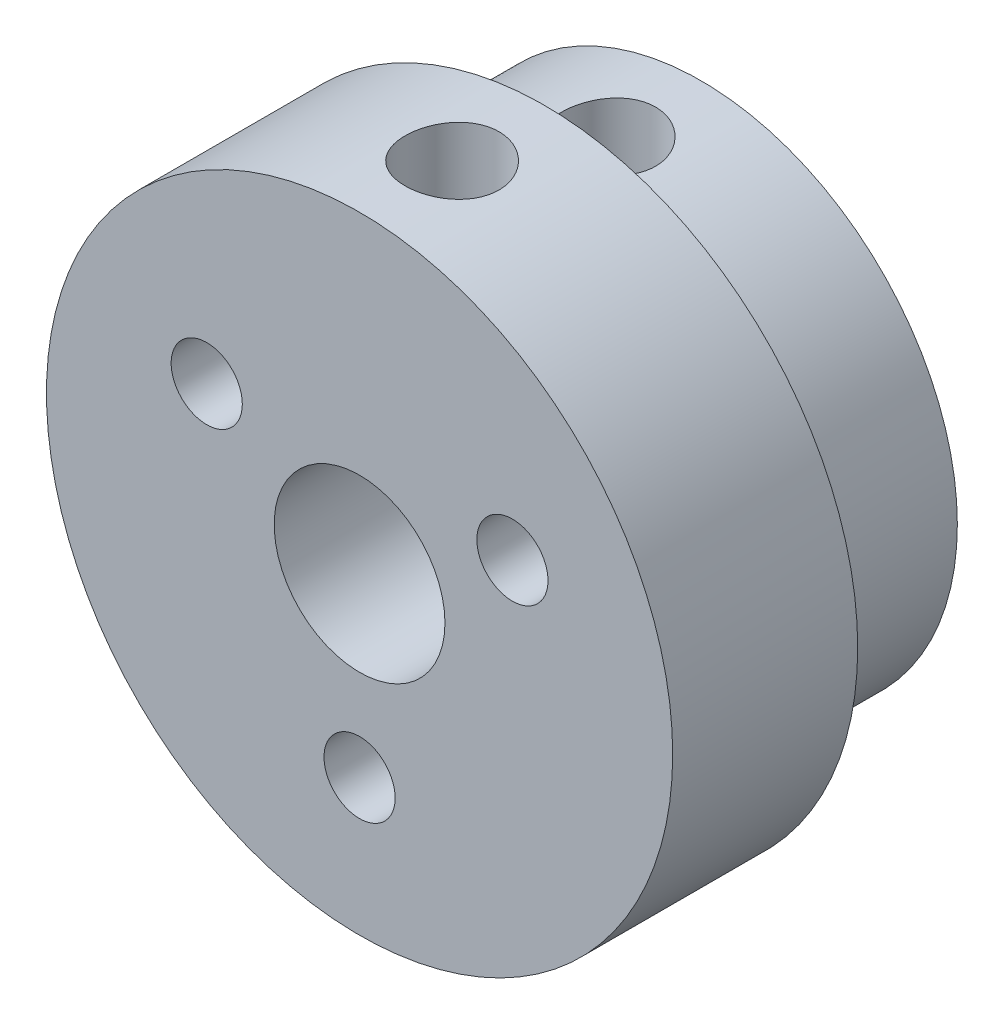
from build123d import *

# Parameters (mm, degrees)
M3X0_5_TAPPED_HOLE1_D               = 2.5
M4X0_7_TAPPED_HOLE1_D               = 3.3
M4X0_7_TAPPED_HOLE1_DEPTH           = 10.999
M4X0_7_TAPPED_HOLE1_TIP             = 0.991420021
M4X0_7_TAPPED_HOLE1_ON_FACE_2_D     = 3.3
M4X0_7_TAPPED_HOLE1_ON_FACE_2_DEPTH = 10.999
M4X0_7_TAPPED_HOLE1_ON_FACE_2_TIP   = 0.991420021


with BuildPart() as part:
    # Sketch2 → Revolve1 (revolve)
    with BuildSketch(Plane(origin=(0, 0, 0), x_dir=(0, 0, -1), z_dir=(1, 0, 0)), mode=Mode.PRIVATE) as revolve1_sk:
        Polygon((0, 3), (0, 11), (6.5, 11), (6.5, 9), (12, 9), (12, 3), align=None)
    revolve(revolve1_sk.sketch.rotate(Axis((0, 0, 0), (0, 0, -1)), 90), axis=Axis((0, 0, 0), (0, 0, -1)))

    # M3x0.5 Tapped Hole1 (through all)
    with Locations(Plane.XY):
        with Locations((35.910466859, 13.470944302), (5.369357503, 3.1), (-5.369357503, 3.1), (0, -6.2)):
            Hole(M3X0_5_TAPPED_HOLE1_D / 2)

    # M4x0.7 Tapped Hole1
    with Locations(Plane(origin=(0, 9, -8.75), x_dir=(1, 0, 0), z_dir=(0, 1, 0))):
        with Locations((0, 0)):
            Hole(M4X0_7_TAPPED_HOLE1_D / 2, depth=M4X0_7_TAPPED_HOLE1_DEPTH)
            with Locations((0, 0, -(M4X0_7_TAPPED_HOLE1_DEPTH + M4X0_7_TAPPED_HOLE1_TIP / 2))):  # 118° drill point
                Cone(0, M4X0_7_TAPPED_HOLE1_D / 2, M4X0_7_TAPPED_HOLE1_TIP, mode=Mode.SUBTRACT)

    # M4x0.7 Tapped Hole1 on face 2
    with Locations(Plane(origin=(0, 11, -3.25), x_dir=(0, 0, 1), z_dir=(0, 1, 0))):
        with Locations((0, 0)):
            Hole(M4X0_7_TAPPED_HOLE1_ON_FACE_2_D / 2, depth=M4X0_7_TAPPED_HOLE1_ON_FACE_2_DEPTH)
            with Locations((0, 0, -(M4X0_7_TAPPED_HOLE1_ON_FACE_2_DEPTH + M4X0_7_TAPPED_HOLE1_ON_FACE_2_TIP / 2))):  # 118° drill point
                Cone(0, M4X0_7_TAPPED_HOLE1_ON_FACE_2_D / 2, M4X0_7_TAPPED_HOLE1_ON_FACE_2_TIP, mode=Mode.SUBTRACT)


solid = part.part
